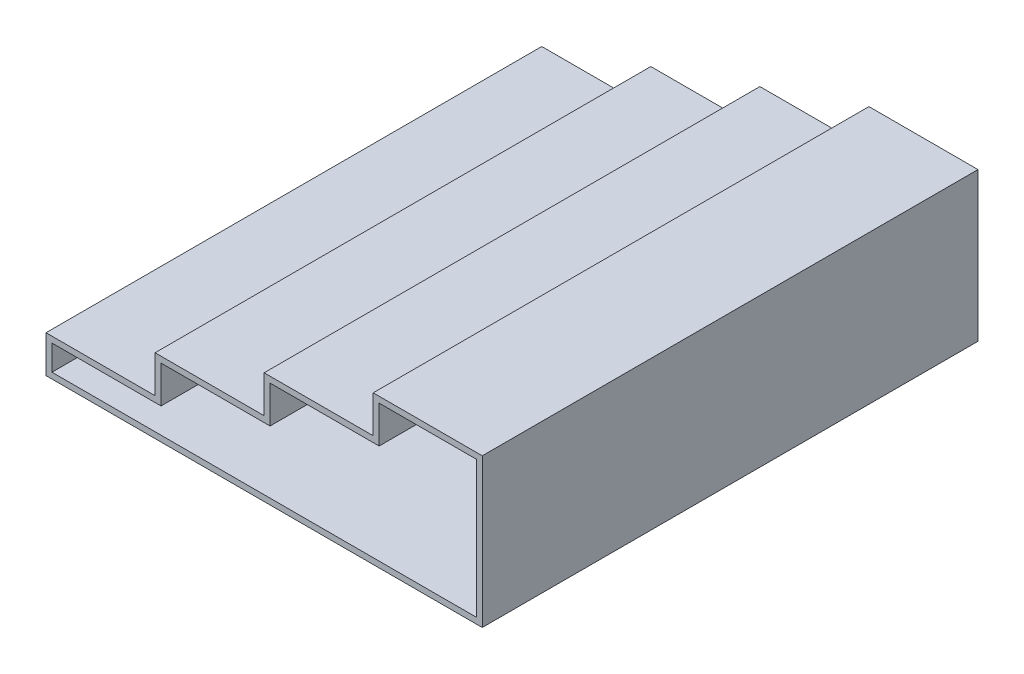
from build123d import *

# Parameters (mm, degrees)
BOSS_EXTRUDE1_DEPTH = 125
SHELL1_T            = -3


with BuildPart() as part:
    # Sketch1 → Boss-Extrude1 (new, symmetric)
    with BuildSketch(Plane.XY):
        Polygon((0, 0), (0, 18.75), (55, 18.75), (55, 37.5), (110, 37.5), (110, 56.25), (165, 56.25), (165, 75), (220, 75), (220, 0), align=None)
    extrude(amount=BOSS_EXTRUDE1_DEPTH, both=True)

    # Shell1
    shell1_openings = [part.faces().sort_by_distance(p)[0] for p in [
        (137.5, 28.125, 125),
    ]]
    offset(amount=SHELL1_T, openings=shell1_openings, kind=Kind.INTERSECTION)


solid = part.part
